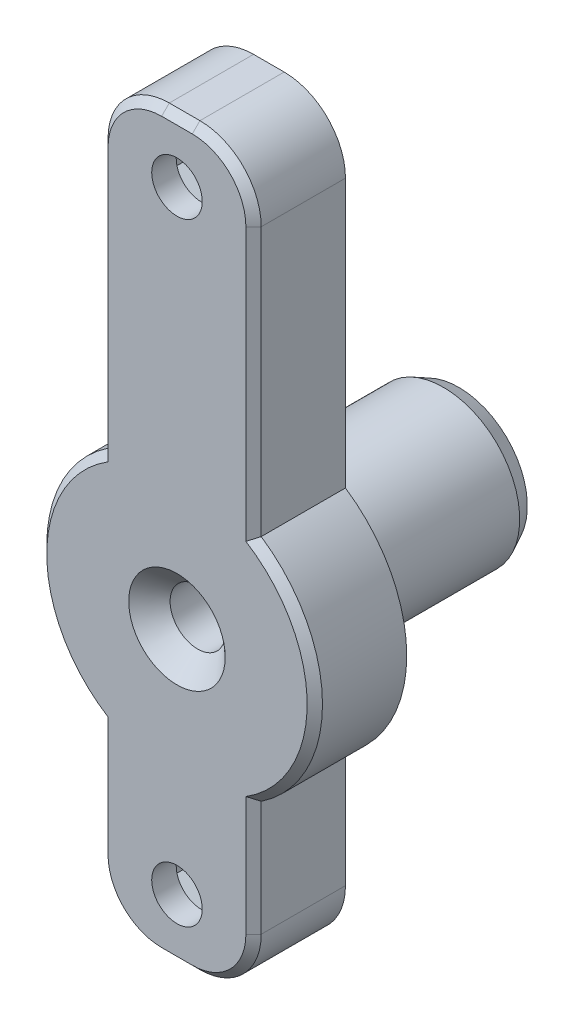
from build123d import *

# Parameters (mm, degrees)
SKETCH1_R                                           = 1.65
SKETCH1_R_2                                         = 1.75
BOSS_EXTRUDE1_DEPTH                                 = 6
CSK_FOR_M3_COUNTERSUNK_FLAT_HEAD_SCREW1_D           = 3.6
CSK_FOR_M3_COUNTERSUNK_FLAT_HEAD_SCREW1_DEPTH       = 47
CSK_FOR_M3_COUNTERSUNK_FLAT_HEAD_SCREW1_CSINK_D     = 6.3
CSK_FOR_M3_COUNTERSUNK_FLAT_HEAD_SCREW1_CSINK_ANGLE = 90
CSK_FOR_M3_COUNTERSUNK_FLAT_HEAD_SCREW1_TIP         = 1.081549114
BOSS_EXTRUDE2_DEPTH                                 = 6
BOSS_EXTRUDE3_START                                 = 1.4
SKETCH5_R                                           = 6
SKETCH5_R_2                                         = 1.8
BOSS_EXTRUDE3_DEPTH                                 = 1.4
BOSS_EXTRUDE4_START                                 = 11
SKETCH6_R                                           = 4.975
SKETCH6_R_2                                         = 1.8
BOSS_EXTRUDE4_DEPTH                                 = 11
CHAMFER1_SIZE                                       = 1
CHAMFER1_SIZE2                                      = 0.5
CUT_EXTRUDE4_DEPTH                                  = 4.4
CHAMFER2_SIZE                                       = 0.5


with BuildPart() as part:
    # Sketch1 → Boss-Extrude1 (new body)
    with BuildSketch(Plane.XY):
        with BuildLine():
            Line((5, 7.483314774), (5, 25))
            ThreePointArc((5, 25), (3.828427125, 27.828427125), (1, 29))
            Line((1, 29), (-1, 29))
            ThreePointArc((-1, 29), (-3.828427125, 27.828427125), (-5, 25))
            Line((-5, 25), (-5, 7.483314774))
            ThreePointArc((-5, 7.483314774), (-9, 0), (-5, -7.483314774))
            Line((-5, -7.483314774), (-5, -15))
            ThreePointArc((-5, -15), (-3.828427125, -17.828427125), (-1, -19))
            Line((-1, -19), (1, -19))
            ThreePointArc((1, -19), (3.828427125, -17.828427125), (5, -15))
            Line((5, -15), (5, -7.483314774))
            ThreePointArc((5, -7.483314774), (9, 0), (5, 7.483314774))
        make_face()
        with Locations((0, 25)):
            Circle(SKETCH1_R, mode=Mode.SUBTRACT)
        with BuildLine():
            Line((-6.988562084, -0.4), (-3.979949748, -0.4))
            ThreePointArc((-3.979949748, -0.4), (-3.464101615, -2), (-2.336385036, -3.246737588))
            Line((-2.336385036, -3.246737588), (-3.840691203, -5.852272301))
            ThreePointArc((-3.840691203, -5.852272301), (-6.062177826, -3.5), (-6.988562084, -0.4))
        make_face(mode=Mode.SUBTRACT)
        with BuildLine():
            ThreePointArc((-1.643564713, -3.646737588), (0, -4), (1.643564713, -3.646737588))
            Line((1.643564713, -3.646737588), (3.14787088, -6.252272301))
            ThreePointArc((3.14787088, -6.252272301), (0, -7), (-3.14787088, -6.252272301))
            Line((-3.14787088, -6.252272301), (-1.643564713, -3.646737588))
        make_face(mode=Mode.SUBTRACT)
        with BuildLine():
            ThreePointArc((2.336385036, -3.246737588), (3.464101615, -2), (3.979949748, -0.4))
            Line((3.979949748, -0.4), (6.988562084, -0.4))
            ThreePointArc((6.988562084, -0.4), (6.062177826, -3.5), (3.840691203, -5.852272301))
            Line((3.840691203, -5.852272301), (2.336385036, -3.246737588))
        make_face(mode=Mode.SUBTRACT)
        with BuildLine():
            ThreePointArc((3.979949748, 0.4), (3.464101615, 2), (2.336385036, 3.246737588))
            Line((2.336385036, 3.246737588), (3.840691203, 5.852272301))
            ThreePointArc((3.840691203, 5.852272301), (6.062177826, 3.5), (6.988562084, 0.4))
            Line((6.988562084, 0.4), (3.979949748, 0.4))
        make_face(mode=Mode.SUBTRACT)
        with BuildLine():
            ThreePointArc((1.643564713, 3.646737588), (0, 4), (-1.643564713, 3.646737588))
            Line((-1.643564713, 3.646737588), (-3.14787088, 6.252272301))
            ThreePointArc((-3.14787088, 6.252272301), (0, 7), (3.14787088, 6.252272301))
            Line((3.14787088, 6.252272301), (1.643564713, 3.646737588))
        make_face(mode=Mode.SUBTRACT)
        with BuildLine():
            ThreePointArc((-2.336385036, 3.246737588), (-3.464101615, 2), (-3.979949748, 0.4))
            Line((-3.979949748, 0.4), (-6.988562084, 0.4))
            ThreePointArc((-6.988562084, 0.4), (-6.062177826, 3.5), (-3.840691203, 5.852272301))
            Line((-3.840691203, 5.852272301), (-2.336385036, 3.246737588))
        make_face(mode=Mode.SUBTRACT)
        with Locations((0, -15)):
            Circle(SKETCH1_R, mode=Mode.SUBTRACT)
        Circle(SKETCH1_R_2, mode=Mode.SUBTRACT)
    extrude(amount=BOSS_EXTRUDE1_DEPTH)

    # CSK for M3 Countersunk Flat Head Screw1
    with Locations(Plane.XY.offset(6)):
        with Locations((0, 0)):
            CounterSinkHole(CSK_FOR_M3_COUNTERSUNK_FLAT_HEAD_SCREW1_D / 2, CSK_FOR_M3_COUNTERSUNK_FLAT_HEAD_SCREW1_CSINK_D / 2, depth=CSK_FOR_M3_COUNTERSUNK_FLAT_HEAD_SCREW1_DEPTH, counter_sink_angle=CSK_FOR_M3_COUNTERSUNK_FLAT_HEAD_SCREW1_CSINK_ANGLE)
            with Locations((0, 0, -(CSK_FOR_M3_COUNTERSUNK_FLAT_HEAD_SCREW1_DEPTH + CSK_FOR_M3_COUNTERSUNK_FLAT_HEAD_SCREW1_TIP / 2))):  # 118° drill point
                Cone(0, CSK_FOR_M3_COUNTERSUNK_FLAT_HEAD_SCREW1_D / 2, CSK_FOR_M3_COUNTERSUNK_FLAT_HEAD_SCREW1_TIP, mode=Mode.SUBTRACT)

    # Sketch1<5> → Boss-Extrude2 (add)
    with BuildSketch(Plane.XY):
        with BuildLine():
            Line((3.640691203, 5.505862139), (2.336385036, 3.246737588))
            ThreePointArc((2.336385036, 3.246737588), (3.464101615, 2), (3.979949748, 0.4))
            Line((3.979949748, 0.4), (6.988562084, 0.4))
            ThreePointArc((6.988562084, 0.4), (6.062177826, 3.5), (3.840691203, 5.852272301))
            Line((3.840691203, 5.852272301), (3.640691203, 5.505862139))
        make_face()
        with BuildLine():
            Line((-2.94787088, 5.905862139), (-1.643564713, 3.646737588))
            ThreePointArc((-1.643564713, 3.646737588), (0, 4), (1.643564713, 3.646737588))
            Line((1.643564713, 3.646737588), (3.14787088, 6.252272301))
            ThreePointArc((3.14787088, 6.252272301), (0, 7), (-3.14787088, 6.252272301))
            Line((-3.14787088, 6.252272301), (-2.94787088, 5.905862139))
        make_face()
        with BuildLine():
            ThreePointArc((-2.336385036, -3.246737588), (-3.464101615, -2), (-3.979949748, -0.4))
            Line((-3.979949748, -0.4), (-6.988562084, -0.4))
            ThreePointArc((-6.988562084, -0.4), (-6.062177826, -3.5), (-3.840691203, -5.852272301))
            Line((-3.840691203, -5.852272301), (-3.640691203, -5.505862139))
            Line((-3.640691203, -5.505862139), (-2.336385036, -3.246737588))
        make_face()
        with BuildLine():
            Line((-6.588562084, 0.4), (-3.979949748, 0.4))
            ThreePointArc((-3.979949748, 0.4), (-3.464101615, 2), (-2.336385036, 3.246737588))
            Line((-2.336385036, 3.246737588), (-3.840691203, 5.852272301))
            ThreePointArc((-3.840691203, 5.852272301), (-6.062177826, 3.5), (-6.988562084, 0.4))
            Line((-6.988562084, 0.4), (-6.588562084, 0.4))
        make_face()
        with BuildLine():
            ThreePointArc((3.979949748, -0.4), (3.464101615, -2), (2.336385036, -3.246737588))
            Line((2.336385036, -3.246737588), (3.840691203, -5.852272301))
            ThreePointArc((3.840691203, -5.852272301), (6.062177826, -3.5), (6.988562084, -0.4))
            Line((6.988562084, -0.4), (6.588562084, -0.4))
            Line((6.588562084, -0.4), (3.979949748, -0.4))
        make_face()
        with BuildLine():
            ThreePointArc((1.643564713, -3.646737588), (0, -4), (-1.643564713, -3.646737588))
            Line((-1.643564713, -3.646737588), (-3.14787088, -6.252272301))
            ThreePointArc((-3.14787088, -6.252272301), (0, -7), (3.14787088, -6.252272301))
            Line((3.14787088, -6.252272301), (2.94787088, -5.905862139))
            Line((2.94787088, -5.905862139), (1.643564713, -3.646737588))
        make_face()
    extrude(amount=BOSS_EXTRUDE2_DEPTH)

    # Sketch5 → Boss-Extrude3 (add)
    with BuildSketch(Plane(origin=(0, 0, 0), x_dir=(-1, 0, 0), z_dir=(0, 0, -1)).offset(BOSS_EXTRUDE3_START)):
        Circle(SKETCH5_R)
        with Locations(Location((0, 0, 0), (0, 0, 180))):
            Circle(SKETCH5_R_2, mode=Mode.SUBTRACT)
    extrude(amount=-BOSS_EXTRUDE3_DEPTH)

    # Sketch6 → Boss-Extrude4 (add)
    with BuildSketch(Plane(origin=(0, 0, -1.4), x_dir=(-1, 0, 0), z_dir=(0, 0, -1)).offset(BOSS_EXTRUDE4_START)):
        Circle(SKETCH6_R)
        with Locations(Location((0, 0, 0), (0, 0, 180))):
            Circle(SKETCH6_R_2, mode=Mode.SUBTRACT)
    extrude(amount=-BOSS_EXTRUDE4_DEPTH)

    # Chamfer1
    chamfer1_edges = [part.edges().sort_by_distance(p)[0] for p in [
        (4.975, 0, -12.4),
    ]]
    chamfer1_side = [part.faces().sort_by_distance(p)[0] for p in [
        (4.975, 0, -6.9),
    ]]
    chamfer(chamfer1_edges, length=CHAMFER1_SIZE, length2=CHAMFER1_SIZE2, reference=chamfer1_side[0])

    # Sketch7 → Cut-Extrude4 (cut)
    with BuildSketch(Plane(origin=(0, 0, 0), x_dir=(-1, 0, 0), z_dir=(0, 0, -1))):
        Polygon((2.85, 23.354551733), (2.85, 26.645448267), (0, 28.290896534), (-2.85, 26.645448267), (-2.85, 23.354551733), (0, 21.709103466), align=None)
        Polygon((2.85, -13.354551733), (0, -11.709103466), (-2.85, -13.354551733), (-2.85, -16.645448267), (0, -18.290896534), (2.85, -16.645448267), align=None)
    extrude(amount=-CUT_EXTRUDE4_DEPTH, mode=Mode.SUBTRACT)

    # Chamfer2
    chamfer2_edges = [part.edges().sort_by_distance(p)[0] for p in [
        (-5, -11.241657387, 6),
        (-3.828427125, -17.828427125, 6),
        (0, -19, 6),
        (3.828427125, -17.828427125, 6),
        (5, -11.241657387, 6),
        (9, 0, 6),
        (5, 16.241657387, 6),
        (3.828427125, 27.828427125, 6),
        (0, 29, 6),
        (-3.828427125, 27.828427125, 6),
        (-5, 16.241657387, 6),
        (-9, 0, 6),
    ]]
    chamfer(chamfer2_edges, length=CHAMFER2_SIZE)


solid = part.part
